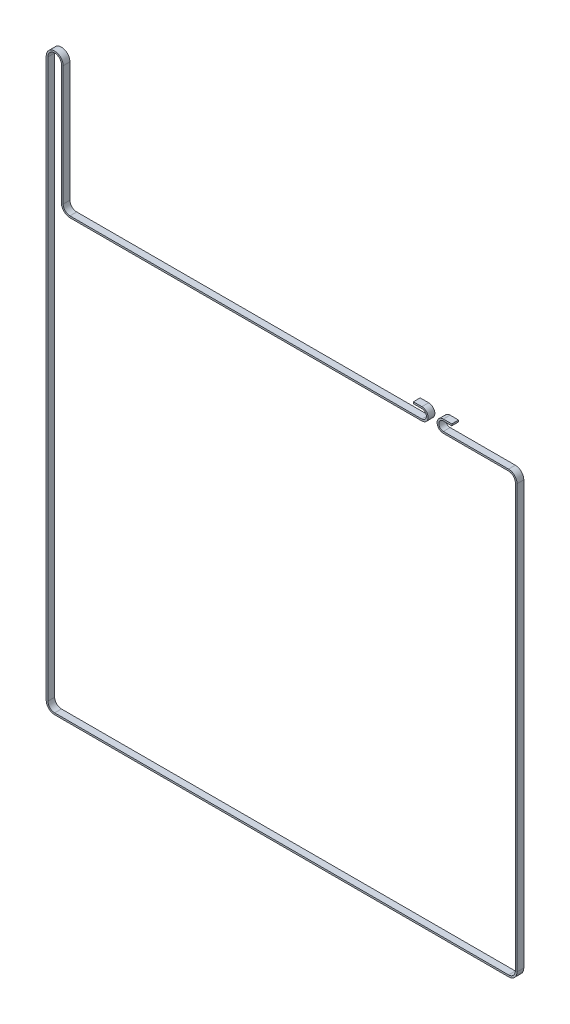
from build123d import *

# Parameters (mm, degrees)
BOSS_EXTRUDE1_DEPTH = 6


with BuildPart() as part:
    # Sketch1 → Boss-Extrude1 (new body)
    with BuildSketch(Plane.XY):
        with BuildLine():
            Line((-6, 0), (-6, -494.15))
            ThreePointArc((-6, -494.15), (-4.242640687, -498.392640687), (0, -500.15))
            Line((0, -500.15), (402, -500.15))
            ThreePointArc((402, -500.15), (406.242640687, -498.392640687), (408, -494.15))
            Line((408, -494.15), (408, -119.649819196))
            ThreePointArc((408, -119.649819196), (406.242640687, -115.407178509), (402, -113.649819196))
            Line((402, -113.649819196), (344.227783268, -113.649819196))
            ThreePointArc((344.227783268, -113.649819196), (338.727783268, -108.149819196), (344.227783268, -102.649819196))
            Line((344.227783268, -102.649819196), (351.727783268, -102.649819196))
            Line((351.727783268, -102.649819196), (351.727783268, -104.149819196))
            Line((351.727783268, -104.149819196), (344.227783268, -104.149819196))
            ThreePointArc((344.227783268, -104.149819196), (340.227783268, -108.149819196), (344.227783268, -112.149819196))
            Line((344.227783268, -112.149819196), (402, -112.149819196))
            ThreePointArc((402, -112.149819196), (407.303300859, -114.346518337), (409.5, -119.649819196))
            Line((409.5, -119.649819196), (409.5, -494.15))
            ThreePointArc((409.5, -494.15), (407.303300859, -499.453300859), (402, -501.65))
            Line((402, -501.65), (0, -501.65))
            ThreePointArc((0, -501.65), (-5.303300859, -499.453300859), (-7.5, -494.15))
            Line((-7.5, -494.15), (-7.5, 0))
            ThreePointArc((-7.5, 0), (0, 7.5), (7.5, 0))
            Line((7.5, 0), (7.5, -106.149819196))
            ThreePointArc((7.5, -106.149819196), (9.257359313, -110.392459883), (13.5, -112.149819196))
            Line((13.5, -112.149819196), (325.227783268, -112.149819196))
            ThreePointArc((325.227783268, -112.149819196), (329.227783268, -108.149819196), (325.227783268, -104.149819196))
            Line((325.227783268, -104.149819196), (317.727783268, -104.149819196))
            Line((317.727783268, -104.149819196), (317.727783268, -102.649819196))
            Line((317.727783268, -102.649819196), (325.227783268, -102.649819196))
            ThreePointArc((325.227783268, -102.649819196), (330.727783268, -108.149819196), (325.227783268, -113.649819196))
            Line((325.227783268, -113.649819196), (13.5, -113.649819196))
            ThreePointArc((13.5, -113.649819196), (8.196699141, -111.453120055), (6, -106.149819196))
            Line((6, -106.149819196), (6, 0))
            ThreePointArc((6, 0), (0, 6), (-6, 0))
        make_face()
    extrude(amount=BOSS_EXTRUDE1_DEPTH)


solid = part.part
